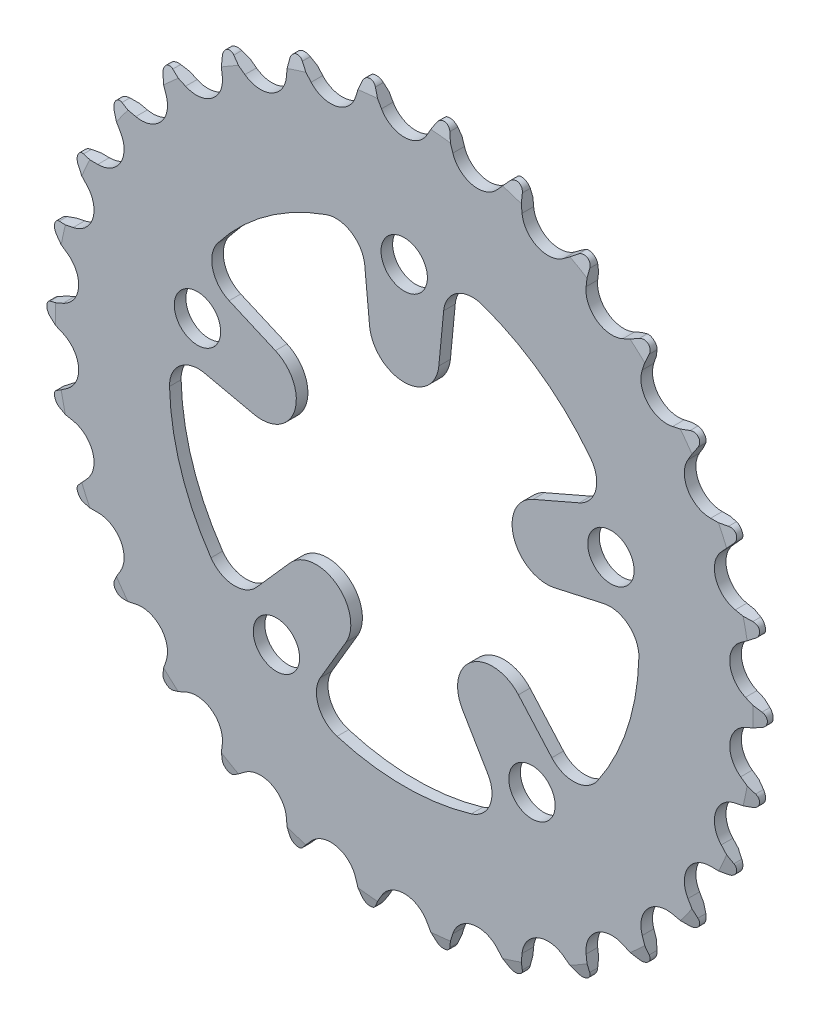
from build123d import *

# Parameters (mm, degrees)
CORTAR_EXTRUIR1_DEPTH   = 87.272823067
MATRIZC1_COUNT          = 30
SALIENTE_EXTRUIR2_DEPTH = 2
MATRIZC2_COUNT          = 30
CORTAR_EXTRUIR2_REACH   = 89.695
CROQUIS9_R              = 4
MATRIZC4_COUNT          = 5


with BuildPart() as part:
    # Croquis6 → Revolución2 (revolve)
    with BuildSketch(Plane(origin=(0, 0, 0), x_dir=(0, 0, -1), z_dir=(1, 0, 0)), mode=Mode.PRIVATE) as revoluci_n2_sk:
        Polygon((-1, 0), (-1, 61), (1, 61), (1, 0), (0, 0), align=None)
    revolve(revoluci_n2_sk.sketch.rotate(Axis((0, 0, 58.112621265), (0, 0, -1)), 90), axis=Axis((0, 0, 58.112621265), (0, 0, -1)))

    # Croquis7 → Cortar-Extruir1 (cut, symmetric)
    with BuildSketch(Plane.XY):
        with BuildLine():
            Line((-3.916600632, 58.78409398), (-5.327169623, 61.277266231))
            ThreePointArc((-5.327169623, 61.277266231), (-5.843127972, 61.773191551), (-6.546571502, 61.904805157))
            ThreePointArc((-6.546571502, 61.904805157), (0, 62.25), (6.546571502, 61.904805157))
            ThreePointArc((6.546571502, 61.904805157), (5.843127972, 61.773191551), (5.327169623, 61.277266231))
            Line((5.327169623, 61.277266231), (3.916600632, 58.78409398))
            ThreePointArc((3.916600632, 58.78409398), (0, 56.5), (-3.916600632, 58.78409398))
        make_face()
    cortar_extruir1 = extrude(amount=CORTAR_EXTRUIR1_DEPTH, both=True, mode=Mode.SUBTRACT)

    # MatrizC1: Cortar-Extruir1 ×30 about axis
    matrizc1_axis = Axis((0, 0, 0), (0, 0, 1))
    for i in range(1, MATRIZC1_COUNT):
        add(cortar_extruir1.rotate(matrizc1_axis, i * 360 / MATRIZC1_COUNT), mode=Mode.SUBTRACT)

    # Croquis8 → Saliente-Extruir2 (add, through all)
    with BuildSketch(Plane.XY.offset(1)):
        with BuildLine():
            Line((-20.110706435, 57.589577935), (-20.066494692, 58.048734438))
            ThreePointArc((-20.066494692, 58.048734438), (-19.208520687, 59.117747893), (-17.886054793, 58.757202308))
            Line((-17.886054793, 58.757202308), (-17.580401321, 58.411723904))
            ThreePointArc((-17.580401321, 58.411723904), (-18.850036657, 58.014447494), (-20.110706435, 57.589577935))
        make_face()
    saliente_extruir2 = extrude(amount=-SALIENTE_EXTRUIR2_DEPTH)

    # MatrizC2: Saliente-Extruir2 ×30 about axis
    matrizc2_axis = Axis((0, 0, 0), (0, 0, 1))
    for i in range(1, MATRIZC2_COUNT):
        add(saliente_extruir2.rotate(matrizc2_axis, i * 360 / MATRIZC2_COUNT))

    # Croquis9 → Cortar-Extruir2 (cut, up to next)
    with BuildSketch(Plane.XY.offset(1), mode=Mode.PRIVATE) as cortar_extruir2_sk1:
        with Locations((0, 37.5)):
            Circle(CROQUIS9_R)
    cortar_extruir2_tool1 = extrude(cortar_extruir2_sk1.sketch, amount=-CORTAR_EXTRUIR2_REACH, mode=Mode.PRIVATE) & part.part
    # Croquis9 → Cortar-Extruir2 (cut, up to next)
    with BuildSketch(Plane.XY.offset(1), mode=Mode.PRIVATE) as cortar_extruir2_sk2:
        with BuildLine():
            Line((-5.97237719, 25.304756681), (-6.806414334, 33.966563601))
            ThreePointArc((-6.806414334, 33.966563601), (-9.092694446, 37.701611618), (-13.443028471, 38.203860872))
            ThreePointArc((-13.443028471, 38.203860872), (-21.577229013, 34.273505629), (-28.637824638, 28.637824638))
            Line((-28.637824638, 28.637824638), (0, 0))
            Line((0, 0), (28.637824638, 28.637824638))
            ThreePointArc((28.637824638, 28.637824638), (21.577229013, 34.273505629), (13.443028471, 38.203860872))
            ThreePointArc((13.443028471, 38.203860872), (9.092694446, 37.701611618), (6.806414334, 33.966563601))
            Line((6.806414334, 33.966563601), (5.97237719, 25.304756681))
            ThreePointArc((5.97237719, 25.304756681), (0, 19.879831196), (-5.97237719, 25.304756681))
        make_face()
    cortar_extruir2_tool2 = extrude(cortar_extruir2_sk2.sketch, amount=-CORTAR_EXTRUIR2_REACH, mode=Mode.PRIVATE) & part.part
    cortar_extruir2_1 = cortar_extruir2_tool1.solids().sort_by_distance((0, 37.5, 1))[0]
    add(cortar_extruir2_1, mode=Mode.SUBTRACT)
    cortar_extruir2_2 = cortar_extruir2_tool2.solids().sort_by_distance((-13.830969, 14.806856, 1))[0]
    add(cortar_extruir2_2, mode=Mode.SUBTRACT)
    cortar_extruir2 = cortar_extruir2_1 + cortar_extruir2_2  # Cortar-Extruir2 as one shape, for the pattern or mirror that repeats it

    # MatrizC4: Cortar-Extruir2 ×5 about axis
    matrizc4_axis = Axis((0, 0, 0), (0, 0, 1))
    for i in range(1, MATRIZC4_COUNT):
        add(cortar_extruir2.rotate(matrizc4_axis, i * 360 / MATRIZC4_COUNT), mode=Mode.SUBTRACT)

    # Croquis12 → Cortar-Revolución1 (revolve, cut)
    with BuildSketch(Plane(origin=(0, 0, 0), x_dir=(1, 0, 0), z_dir=(0, 1, 0))):
        Polygon((-62.160078691, 0.5), (-60.154688225, 1), (-62.160078691, 1), align=None)
        Polygon((-62.160078691, -0.5), (-60.154688225, -1), (-62.160078691, -1), align=None)
    revolve(axis=Axis((0, 0, -9.858263743), (0, 0, 1)), mode=Mode.SUBTRACT)


solid = part.part
